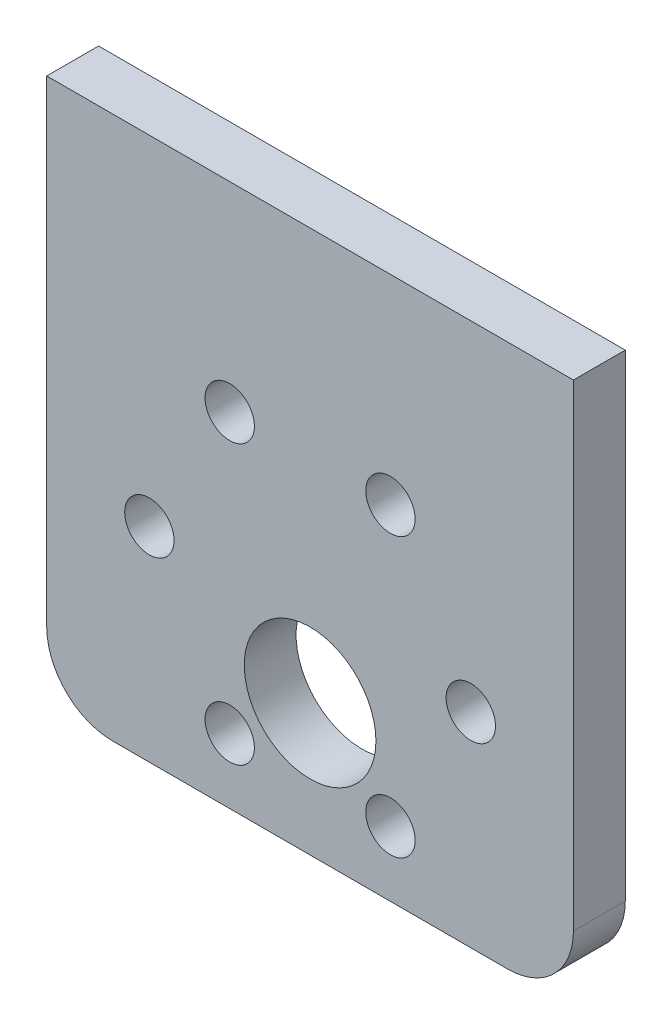
from build123d import *

# Parameters (mm, degrees)
SKETCH1_W                      = 50.8
SKETCH1_H                      = 52.3748
BOSS_EXTRUDE1_DEPTH            = 2.5
F_1_2_0_5_DIAMETER_HOLE1_D     = 12.7
F_3_16_0_1875_DIAMETER_HOLE1_D = 4.7625
FILLET1_R                      = 6.35


with BuildPart() as part:
    # Sketch1 → Boss-Extrude1 (new, symmetric)
    with BuildSketch(Plane.XY):
        Rectangle(SKETCH1_W, SKETCH1_H)
    extrude(amount=BOSS_EXTRUDE1_DEPTH, both=True)

    # 1/2 (0.5) Diameter Hole1 (through all)
    with Locations(Plane.XY.offset(2.5)):
        with Locations((0, -13.4874)):
            Hole(F_1_2_0_5_DIAMETER_HOLE1_D / 2)

    # 3/16 (0.1875) Diameter Hole1 (through all)
    with Locations(Plane(origin=(0, 0, -2.5), x_dir=(-1, 0, 0), z_dir=(0, 0, -1))):
        with Locations((15.5, -6.4874), (7.75, 6.935993759), (-7.75, 6.935993759), (-15.5, -6.4874), (7.75, -19.910793759), (-7.75, -19.910793759)):
            Hole(F_3_16_0_1875_DIAMETER_HOLE1_D / 2)

    # Fillet1
    fillet1_edges = [part.edges().sort_by_distance(p)[0] for p in [
        (25.4, -26.1874, 0),
        (-25.4, -26.1874, 0),
    ]]
    fillet(fillet1_edges, radius=FILLET1_R)


solid = part.part
